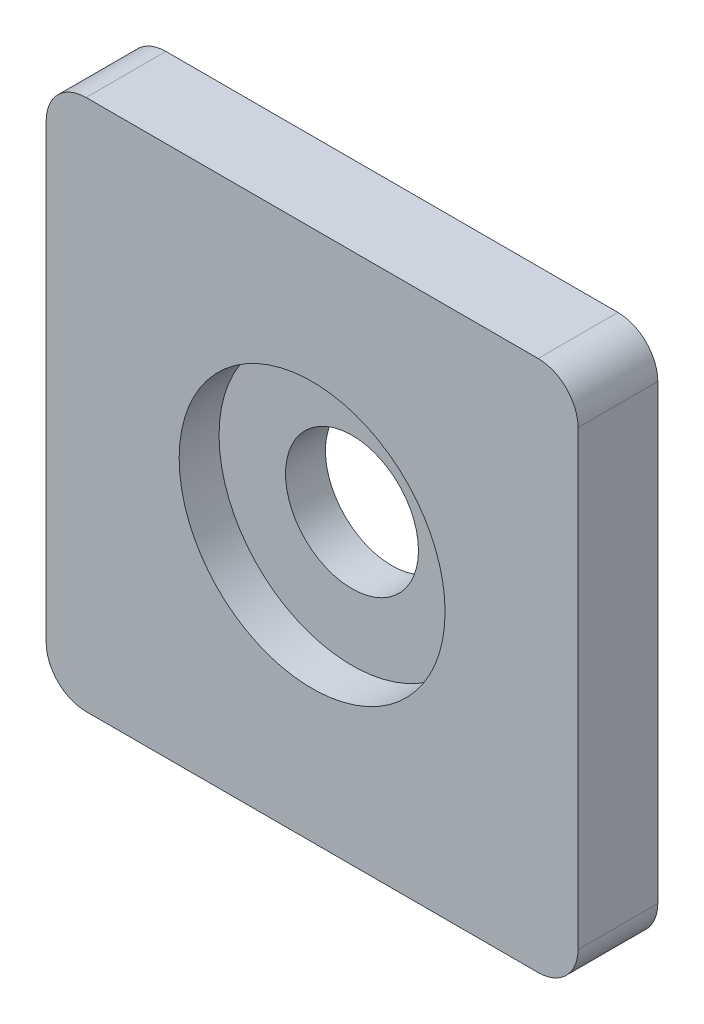
from build123d import *

# Parameters (mm, degrees)
ESQUISSE1_R             = 2.5
BOSS_EXTRU_1_DEPTH      = 1.5
ENL_V_START             = -1.5
ESQUISSE2_R             = 5
ENL_V_MAT_EXTRU_1_DEPTH = 1.5


with BuildPart() as part:
    # Esquisse1 → Boss.-Extru.1 (new, symmetric)
    with BuildSketch(Plane.XY):
        with BuildLine():
            Line((-8.5, -10), (8.5, -10))
            ThreePointArc((8.5, -10), (9.560660172, -9.560660172), (10, -8.5))
            Line((10, -8.5), (10, 8.5))
            ThreePointArc((10, 8.5), (9.560660172, 9.560660172), (8.5, 10))
            Line((8.5, 10), (-8.5, 10))
            ThreePointArc((-8.5, 10), (-9.560660172, 9.560660172), (-10, 8.5))
            Line((-10, 8.5), (-10, -8.5))
            ThreePointArc((-10, -8.5), (-9.560660172, -9.560660172), (-8.5, -10))
        make_face()
        Circle(ESQUISSE1_R, mode=Mode.SUBTRACT)
    extrude(amount=BOSS_EXTRU_1_DEPTH, both=True)

    # Esquisse2 → Enlèv. mat.-Extru.1 (cut)
    with BuildSketch(Plane.XY.offset(1.5).offset(ENL_V_START)):
        Circle(ESQUISSE2_R)
    extrude(amount=ENL_V_MAT_EXTRU_1_DEPTH, mode=Mode.SUBTRACT)


solid = part.part
